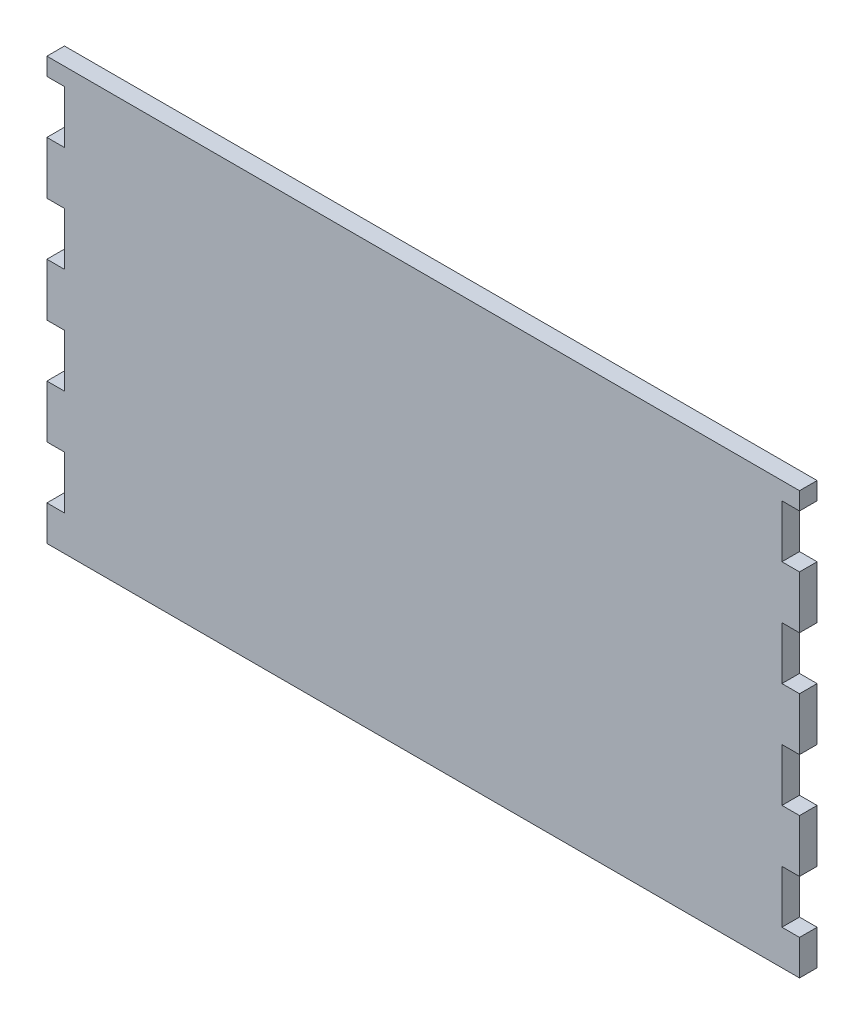
from build123d import *

# Parameters (mm, degrees)
SKETCH1_W               = 271.78
SKETCH1_H               = 152.4
BOSS_EXTRUDE1_DEPTH     = 6.35
SKETCH2_W               = 6.35
SKETCH2_H               = 19.05
CUT_EXTRUDE1_DEPTH      = 156.925798379
LPATTERN1_COUNT         = 4
LPATTERN1_PITCH         = 38.1
MIRROR1_COPY_1_SKETCH_W = 6.35
MIRROR1_COPY_1_SKETCH_H = 19.05
MIRROR1_COPY_1_DEPTH    = 156.925798379
MIRROR1_COPY_2_SKETCH_W = 6.35
MIRROR1_COPY_2_SKETCH_H = 19.05
MIRROR1_COPY_2_DEPTH    = 156.925798379
MIRROR1_COPY_3_SKETCH_W = 6.35
MIRROR1_COPY_3_SKETCH_H = 19.05
MIRROR1_COPY_3_DEPTH    = 156.925798379


with BuildPart() as part:
    # Sketch1 → Boss-Extrude1 (new body)
    with BuildSketch(Plane.XY):
        Rectangle(SKETCH1_W, SKETCH1_H)
    extrude(amount=BOSS_EXTRUDE1_DEPTH)

    # Sketch2 → Cut-Extrude1 (cut, through all)
    with BuildSketch(Plane.XY.offset(6.35)):
        with Locations((-132.715, 60.325)):
            Rectangle(SKETCH2_W, SKETCH2_H)
    cut_extrude1 = extrude(amount=-CUT_EXTRUDE1_DEPTH, mode=Mode.SUBTRACT)

    # LPattern1: Cut-Extrude1 ×4
    with Locations(*[(0, -i * LPATTERN1_PITCH, 0) for i in range(1, LPATTERN1_COUNT)]):
        add(cut_extrude1, mode=Mode.SUBTRACT)

    # Mirror1: Cut-Extrude1 across plane
    add(cut_extrude1.mirror(Plane(origin=(0, 0, 0), x_dir=(0, 0, 1), z_dir=(1, 0, 0))), mode=Mode.SUBTRACT)

    # Mirror1 copy 1 sketch → Mirror1 copy 1 (cut, through all)
    with BuildSketch(Plane(origin=(0, -38.1, 6.35), x_dir=(-1, 0, 0), z_dir=(0, 0, 1))):
        with Locations((-132.715, -60.325)):
            Rectangle(MIRROR1_COPY_1_SKETCH_W, MIRROR1_COPY_1_SKETCH_H)
    extrude(amount=-MIRROR1_COPY_1_DEPTH, mode=Mode.SUBTRACT)

    # Mirror1 copy 2 sketch → Mirror1 copy 2 (cut, through all)
    with BuildSketch(Plane(origin=(0, -76.2, 6.35), x_dir=(-1, 0, 0), z_dir=(0, 0, 1))):
        with Locations((-132.715, -60.325)):
            Rectangle(MIRROR1_COPY_2_SKETCH_W, MIRROR1_COPY_2_SKETCH_H)
    extrude(amount=-MIRROR1_COPY_2_DEPTH, mode=Mode.SUBTRACT)

    # Mirror1 copy 3 sketch → Mirror1 copy 3 (cut, through all)
    with BuildSketch(Plane(origin=(0, -114.3, 6.35), x_dir=(-1, 0, 0), z_dir=(0, 0, 1))):
        with Locations((-132.715, -60.325)):
            Rectangle(MIRROR1_COPY_3_SKETCH_W, MIRROR1_COPY_3_SKETCH_H)
    extrude(amount=-MIRROR1_COPY_3_DEPTH, mode=Mode.SUBTRACT)


solid = part.part
